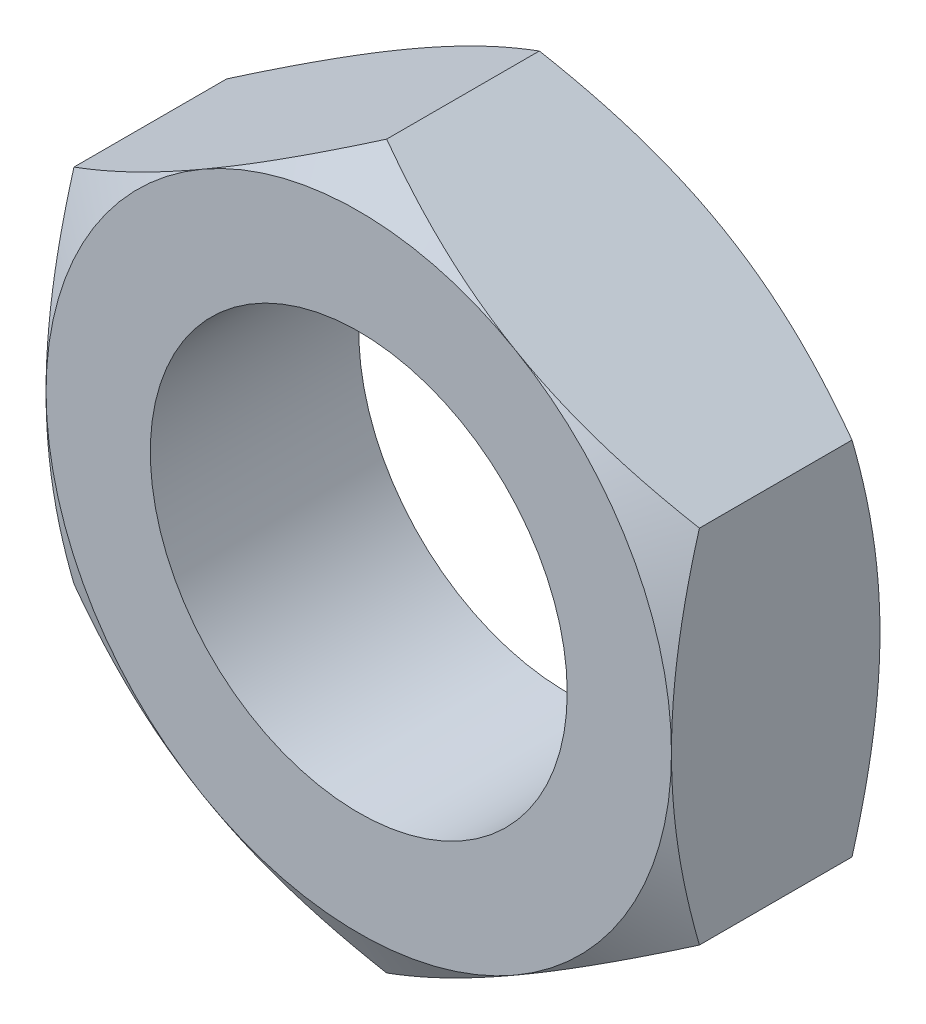
from build123d import *

# Parameters (mm, degrees)
SZKIC1_R                    = 10
DODANIE_WYCI_GNI_CIE1_DEPTH = 5
SZKIC2_OUTSIDE_W            = 76.022
SZKIC2_OUTSIDE_H            = 80.664
SZKIC2_OUTSIDE_R            = 15
WYTNIJ_WYCI_GNI_CIE2_DEPTH  = 10
WYTNIJ_WYCI_GNI_CIE2_DRAFT  = -60
LUSTRO1_COPY_1_SKETCH_W     = 76.022
LUSTRO1_COPY_1_SKETCH_H     = 80.664
LUSTRO1_COPY_1_SKETCH_R     = 15
LUSTRO1_COPY_1_DEPTH        = 10
LUSTRO1_COPY_1_DRAFT        = -60


with BuildPart() as part:
    # Szkic1 → Dodanie-wyciągnięcie1 (new, symmetric)
    with BuildSketch(Plane.XY):
        Polygon((-15, 8.660254038), (-15, -8.660254038), (0, -17.320508076), (15, -8.660254038), (15, 8.660254038), (0, 17.320508076), align=None)
        Circle(SZKIC1_R, mode=Mode.SUBTRACT)
    extrude(amount=DODANIE_WYCI_GNI_CIE1_DEPTH, both=True)


with BuildPart() as wytnij_wyci_gni_cie2_tool:
    # Szkic2 outside → Wytnij-wyciągnięcie2 (with draft: the straight prism first)
    with BuildSketch(Plane.XY.offset(5)):
        Rectangle(SZKIC2_OUTSIDE_W, SZKIC2_OUTSIDE_H)
        Circle(SZKIC2_OUTSIDE_R, mode=Mode.SUBTRACT)
    extrude(amount=-WYTNIJ_WYCI_GNI_CIE2_DEPTH)
    # Wytnij-wyciągnięcie2: the draft: its side faces are tilted about the plane it starts from
    wytnij_wyci_gni_cie2_sides = [wytnij_wyci_gni_cie2_tool.faces().sort_by_distance(p)[0] for p in [
        (0, -40.332, 0),
        (38.011, 0, 0),
        (0, 40.332, 0),
        (-38.011, 0, 0),
        (-15, 0, 0),
    ]]
    draft(wytnij_wyci_gni_cie2_sides, Plane.XY.offset(5), WYTNIJ_WYCI_GNI_CIE2_DRAFT)


with BuildPart() as part_1:
    add(part.part)

    # Wytnij-wyciągnięcie2: cut by wytnij_wyci_gni_cie2_tool
    add(wytnij_wyci_gni_cie2_tool.part, mode=Mode.SUBTRACT)


with BuildPart() as lustro1_copy_1_tool:
    # Lustro1 copy 1 sketch → Lustro1 copy 1 (with draft: the straight prism first)
    with BuildSketch(Plane(origin=(0, 0, -5), x_dir=(1, 0, 0), z_dir=(0, 0, -1))):
        Rectangle(LUSTRO1_COPY_1_SKETCH_W, LUSTRO1_COPY_1_SKETCH_H)
        Circle(LUSTRO1_COPY_1_SKETCH_R, mode=Mode.SUBTRACT)
    extrude(amount=-LUSTRO1_COPY_1_DEPTH)
    # Lustro1 copy 1: the draft: its side faces are tilted about the plane it starts from
    lustro1_copy_1_sides = [lustro1_copy_1_tool.faces().sort_by_distance(p)[0] for p in [
        (0, -40.332, 0),
        (38.011, 0, 0),
        (0, 40.332, 0),
        (-38.011, 0, 0),
        (-15, 0, 0),
    ]]
    draft(lustro1_copy_1_sides, Plane(origin=(0, 0, -5), x_dir=(1, 0, 0), z_dir=(0, 0, -1)), LUSTRO1_COPY_1_DRAFT)


with BuildPart() as part_2:
    add(part_1.part)

    # Lustro1 copy 1: cut by lustro1_copy_1_tool
    add(lustro1_copy_1_tool.part, mode=Mode.SUBTRACT)


solid = part_2.part
